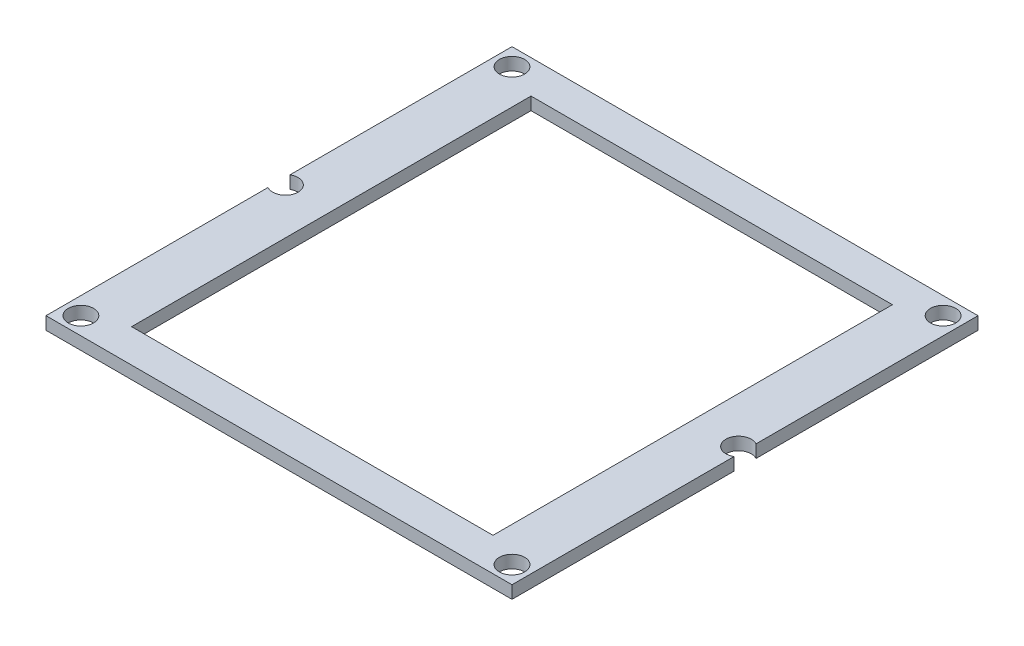
from build123d import *

# Parameters (mm, degrees)
SKETCH1_W               = 294
SKETCH1_H               = 294
SKETCH1_W_2             = 228
SKETCH1_H_2             = 252
BOSS_EXTRUDE1_DEPTH     = 8
SKETCH2_R               = 8
CUT_EXTRUDE1_DEPTH      = 209.043264731
SKETCH4_R               = 8
CUT_EXTRUDE2_DEPTH      = 209.043264731
MIRROR3_COPY_1_SKETCH_R = 8
MIRROR3_COPY_1_DEPTH    = 209.043264731


with BuildPart() as part:
    # Sketch1 → Boss-Extrude1 (new body)
    with BuildSketch(Plane(origin=(0, 0, 0), x_dir=(1, 0, 0), z_dir=(0, 1, 0))):
        Rectangle(SKETCH1_W, SKETCH1_H)
        Rectangle(SKETCH1_W_2, SKETCH1_H_2, mode=Mode.SUBTRACT)
    extrude(amount=BOSS_EXTRUDE1_DEPTH)

    # Sketch2 → Cut-Extrude1 (cut, through all)
    with BuildSketch(Plane(origin=(0, 0, 0), x_dir=(1, 0, 0), z_dir=(0, 1, 0))):
        with Locations(Location((136, 136, 0), (0, 0, 270))):
            Circle(SKETCH2_R)
    cut_extrude1 = extrude(amount=CUT_EXTRUDE1_DEPTH, mode=Mode.SUBTRACT)

    # Mirror2: Cut-Extrude1 across plane
    add(cut_extrude1.mirror(Plane.XY), mode=Mode.SUBTRACT)

    # Sketch4 → Cut-Extrude2 (cut, through all)
    with BuildSketch(Plane(origin=(0, 8, 0), x_dir=(1, 0, 0), z_dir=(0, 1, 0))):
        with Locations((142.94, 0)):
            Circle(SKETCH4_R)
    cut_extrude2 = extrude(amount=-CUT_EXTRUDE2_DEPTH, mode=Mode.SUBTRACT)

    # Mirror3: Cut-Extrude1, Cut-Extrude2 across plane
    add(cut_extrude1.mirror(Plane(origin=(0, 0, 0), x_dir=(0, 0, 1), z_dir=(1, 0, 0))), mode=Mode.SUBTRACT)
    add(cut_extrude2.mirror(Plane(origin=(0, 0, 0), x_dir=(0, 0, 1), z_dir=(1, 0, 0))), mode=Mode.SUBTRACT)

    # Mirror3 copy 1 sketch → Mirror3 copy 1 (cut, through all)
    with BuildSketch(Plane(origin=(0, 0, 0), x_dir=(-1, 0, 0), z_dir=(0, 1, 0))):
        with Locations(Location((136, 136, 0), (0, 0, 270))):
            Circle(MIRROR3_COPY_1_SKETCH_R)
    extrude(amount=MIRROR3_COPY_1_DEPTH, mode=Mode.SUBTRACT)


solid = part.part
